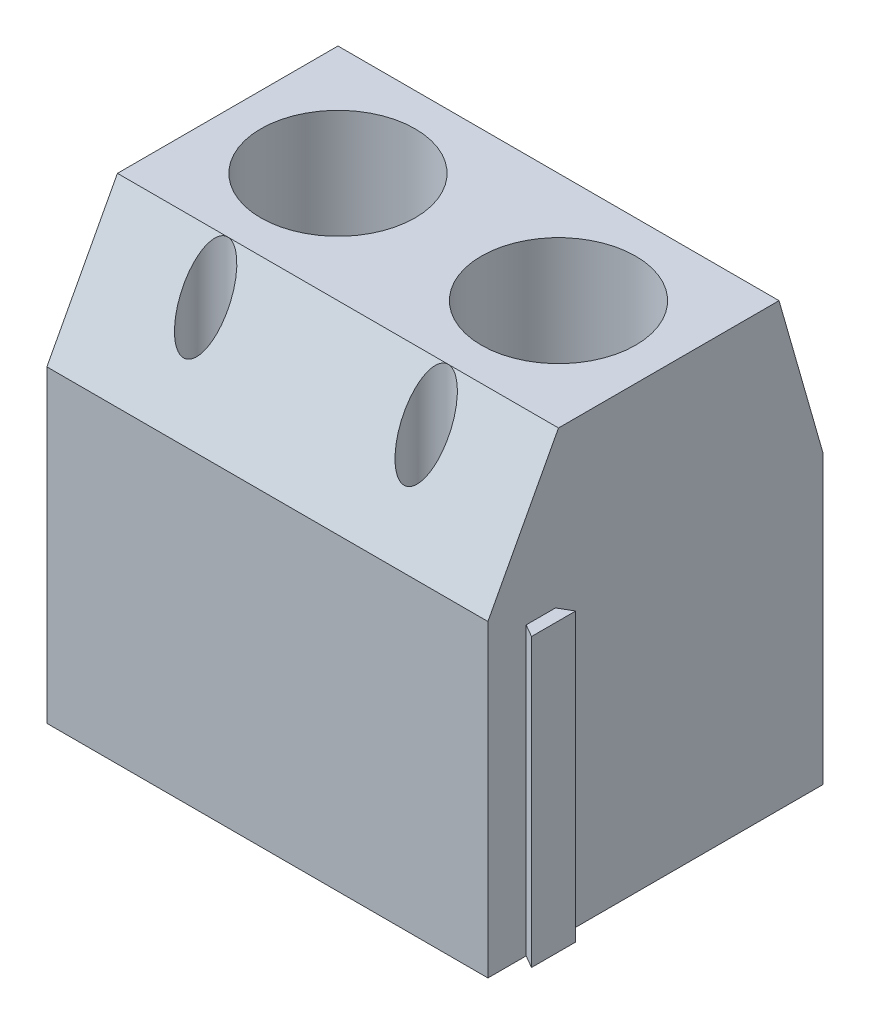
from build123d import *

# Parameters (mm, degrees)
BOSS_EXTRUDE1_DEPTH = 6.5
SKETCH2_W           = 4
SKETCH2_H           = 5
CUT_EXTRUDE1_DEPTH  = 7
CUT_EXTRUDE2_DEPTH  = 0.5
BOSS_EXTRUDE2_DEPTH = 10
SKETCH5_R           = 1.75
SKETCH5_R_2         = 0.5
CUT_EXTRUDE3_DEPTH  = 3.5
SKETCH7_R           = 1
CUT_EXTRUDE4_DEPTH  = 1


with BuildPart() as part:
    # Sketch1 → Boss-Extrude1 (new body)
    with BuildSketch(Plane(origin=(0, 0, 0), x_dir=(1, 0, 0), z_dir=(0, 1, 0))):
        Polygon((-4.748160816, 3.12599073), (-4.748160816, 3.933170407), (5.060522517, 3.933170407), (5.251839184, 3.933170407), (5.251839184, 2.992820323), (5.251839184, 1.607179677), (5.251839184, -2.13349626), (5.540514319, -1.966829593), (5.540514319, -2.966829593), (5.251839184, -2.800162927), (5.251839184, -3.666829593), (-4.748160816, -3.666829593), (-4.748160816, -2.800162927), (-4.459485681, -2.966829593), (-4.459485681, -1.966829593), (-4.748160816, -2.13349626), (-4.748160816, 1.740350084), align=None)
    extrude(amount=BOSS_EXTRUDE1_DEPTH)

    # Sketch2 → Cut-Extrude1 (cut)
    with BuildSketch(Plane(origin=(0, 0, -3.933170407), x_dir=(-1, 0, 0), z_dir=(0, 0, -1))):
        with Locations((-2.751839184, 3)):
            Rectangle(SKETCH2_W, SKETCH2_H)
        with Locations((2.248160816, 3)):
            Rectangle(SKETCH2_W, SKETCH2_H)
    extrude(amount=-CUT_EXTRUDE1_DEPTH, mode=Mode.SUBTRACT)

    # Sketch3 → Cut-Extrude2 (cut)
    with BuildSketch(Plane(origin=(0, 0, 0), x_dir=(-1, 0, 0), z_dir=(0, -1, 0))):
        with BuildLine():
            Line((-3.25, 3.933170407), (-2.25, 3.933170407))
            Line((-2.25, 3.933170407), (-2.25, -0.576829593))
            ThreePointArc((-2.25, -0.576829593), (-2.393517677, -0.923311916), (-2.74, -1.066829593))
            Line((-2.74, -1.066829593), (-2.76, -1.066829593))
            ThreePointArc((-2.76, -1.066829593), (-3.106482323, -0.923311916), (-3.25, -0.576829593))
            Line((-3.25, -0.576829593), (-3.25, 3.933170407))
        make_face()
        with BuildLine():
            Line((1.75, 3.933170407), (2.75, 3.933170407))
            Line((2.75, 3.933170407), (2.75, -0.576829593))
            ThreePointArc((2.75, -0.576829593), (2.606482323, -0.923311916), (2.26, -1.066829593))
            Line((2.26, -1.066829593), (2.24, -1.066829593))
            ThreePointArc((2.24, -1.066829593), (1.893517677, -0.923311916), (1.75, -0.576829593))
            Line((1.75, -0.576829593), (1.75, 3.933170407))
        make_face()
    extrude(amount=-CUT_EXTRUDE2_DEPTH, mode=Mode.SUBTRACT)

    # Sketch4 → Boss-Extrude2 (add)
    with BuildSketch(Plane(origin=(5.251839184, 0, 0), x_dir=(0, 0, -1), z_dir=(1, 0, 0))):
        Polygon((3.933170407, 6.5), (-3.666829593, 6.5), (-3.666829593, 7), (-2.066829593, 10), (2.933170407, 10), align=None)
    extrude(amount=-BOSS_EXTRUDE2_DEPTH)

    # Sketch5 → Cut-Extrude3 (cut)
    with BuildSketch(Plane(origin=(0, 10, 0), x_dir=(1, 0, 0), z_dir=(0, 1, 0))):
        with Locations(Location((-2.248160816, 0.433170407, 0), (0, 0, 270))):
            Circle(SKETCH5_R)
        with Locations(Location((2.751839184, 0.433170407, 0), (0, 0, 270))):
            Circle(SKETCH5_R)
        with Locations(Location((-2.248160816, -2.566829593, 0), (0, 0, 270))):
            Circle(SKETCH5_R_2)
        with Locations(Location((2.751839184, -2.566829593, 0), (0, 0, 270))):
            Circle(SKETCH5_R_2)
    extrude(amount=-CUT_EXTRUDE3_DEPTH, mode=Mode.SUBTRACT)

    # Sketch7 → Cut-Extrude4 (cut)
    with BuildSketch(Plane(origin=(0, 6.5, 0), x_dir=(1, 0, 0), z_dir=(0, 1, 0))):
        with Locations(Location((-2.25, 0.433170407, 0), (0, 0, 270))):
            Circle(SKETCH7_R)
        with Locations(Location((2.751839184, 0.433170407, 0), (0, 0, 270))):
            Circle(SKETCH7_R)
    extrude(amount=-CUT_EXTRUDE4_DEPTH, mode=Mode.SUBTRACT)


solid = part.part
